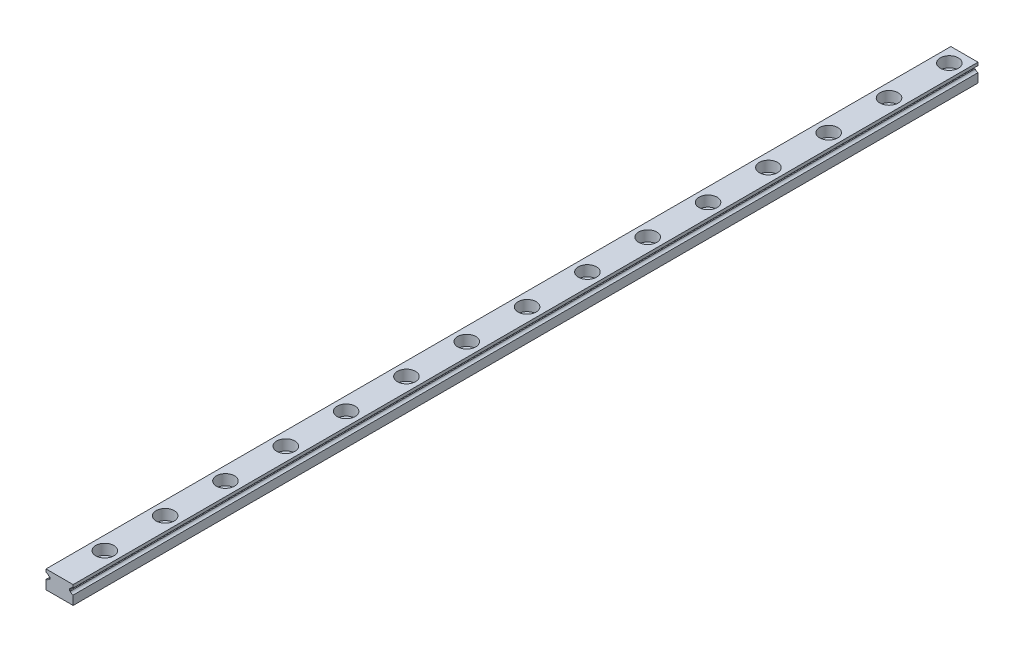
from build123d import *

# Parameters (mm, degrees)
EXTRUDE1_DEPTH  = 300
SKETCH2_R       = 3
EXTRUDE2_DEPTH  = 3.5
SKETCH_R        = 1.75
EXTRUDE3_DEPTH  = 301.093735356
LPATTERN1_COUNT = 15
LPATTERN1_PITCH = 20


with BuildPart() as part:
    # Sketch1 → Extrude1 (new body)
    with BuildSketch(Plane.XY):
        with BuildLine():
            Line((-4.5, -3), (4.5, -3))
            Line((4.5, -3), (4.5, 0))
            ThreePointArc((4.5, 0), (3.93077967, 0.177814974), (3.563991137, 0.648023568))
            Line((3.563991137, 0.648023568), (3.235073025, 0.648023568))
            Line((3.235073025, 0.648023568), (3.235073025, 1.351976432))
            Line((3.235073025, 1.351976432), (3.563991137, 1.351976432))
            ThreePointArc((3.563991137, 1.351976432), (3.93077967, 1.822185026), (4.5, 2))
            Line((4.5, 2), (4.5, 3))
            Line((4.5, 3), (-4.5, 3))
            Line((-4.5, 3), (-4.5, 2))
            ThreePointArc((-4.5, 2), (-3.93077967, 1.822185026), (-3.563991137, 1.351976432))
            Line((-3.563991137, 1.351976432), (-3.235073025, 1.351976432))
            Line((-3.235073025, 1.351976432), (-3.235073025, 0.648023568))
            Line((-3.235073025, 0.648023568), (-3.563991137, 0.648023568))
            ThreePointArc((-3.563991137, 0.648023568), (-3.93077967, 0.177814974), (-4.5, 0))
            Line((-4.5, 0), (-4.5, -3))
        make_face()
    extrude(amount=EXTRUDE1_DEPTH)

    # Sketch2 → Extrude2 (cut)
    with BuildSketch(Plane(origin=(0, 3, 0), x_dir=(1, 0, 0), z_dir=(0, 1, 0))):
        with Locations(Location((0, -5, 0), (0, 0, 270))):
            Circle(SKETCH2_R)
    extrude2 = extrude(amount=-EXTRUDE2_DEPTH, mode=Mode.SUBTRACT)

    # Sketch → Extrude3 (cut, through all)
    with BuildSketch(Plane(origin=(0, 3, 0), x_dir=(1, 0, 0), z_dir=(0, 1, 0))):
        with Locations(Location((0, -5, 0), (0, 0, 270))):
            Circle(SKETCH_R)
    extrude3 = extrude(amount=-EXTRUDE3_DEPTH, mode=Mode.SUBTRACT)

    # LPattern1: Extrude2, Extrude3 ×15
    with Locations(*[(0, 0, i * LPATTERN1_PITCH) for i in range(1, LPATTERN1_COUNT)]):
        add(extrude2, mode=Mode.SUBTRACT)
        add(extrude3, mode=Mode.SUBTRACT)


solid = part.part
